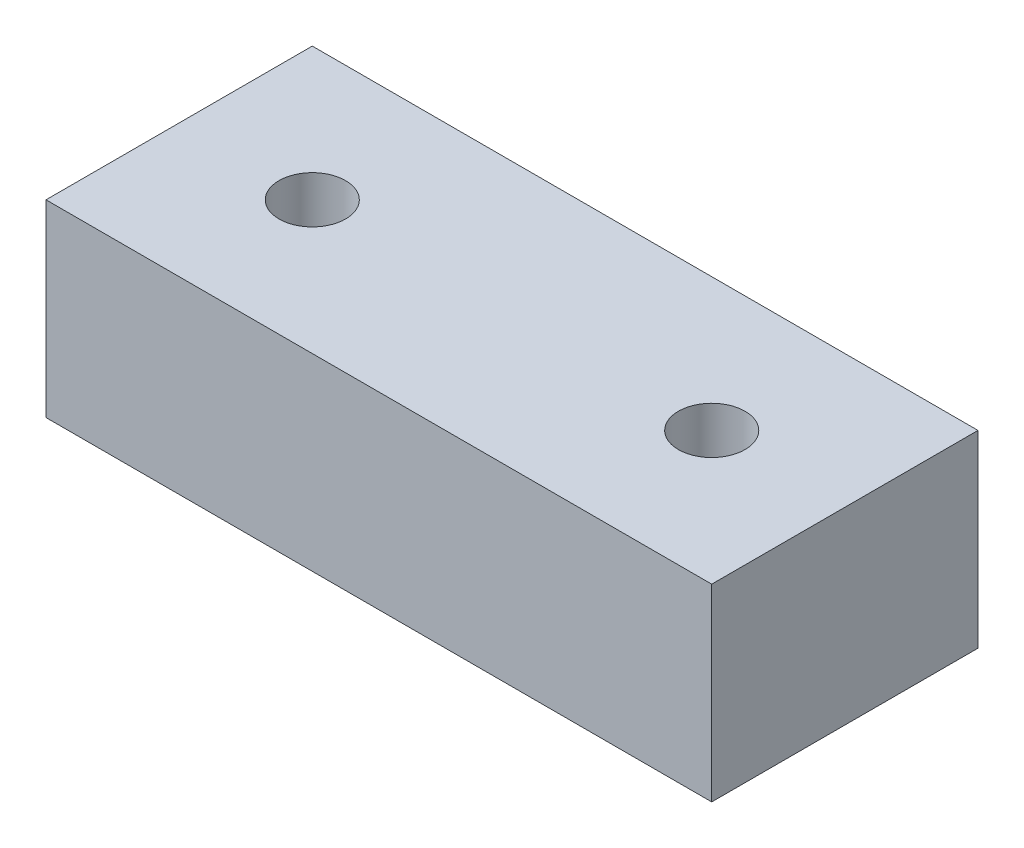
from build123d import *

# Parameters (mm, degrees)
SKETCH1_W           = 30
SKETCH1_H           = 12
BOSS_EXTRUDE1_DEPTH = 8.5
SKETCH2_R           = 1.5
CUT_EXTRUDE1_DEPTH  = 19.255136264


with BuildPart() as part:
    # Sketch1 → Boss-Extrude1 (new body)
    with BuildSketch(Plane(origin=(0, 0, 0), x_dir=(1, 0, 0), z_dir=(0, 1, 0))):
        Rectangle(SKETCH1_W, SKETCH1_H)
    extrude(amount=BOSS_EXTRUDE1_DEPTH)

    # Sketch2 → Cut-Extrude1 (cut, through all)
    with BuildSketch(Plane(origin=(0, 8.5, 0), x_dir=(1, 0, 0), z_dir=(0, 1, 0))):
        with Locations(Location((-9, 0, 0), (0, 0, 270))):
            Circle(SKETCH2_R)
        with Locations(Location((9, 0, 0), (0, 0, 270))):
            Circle(SKETCH2_R)
    extrude(amount=-CUT_EXTRUDE1_DEPTH, mode=Mode.SUBTRACT)


solid = part.part
